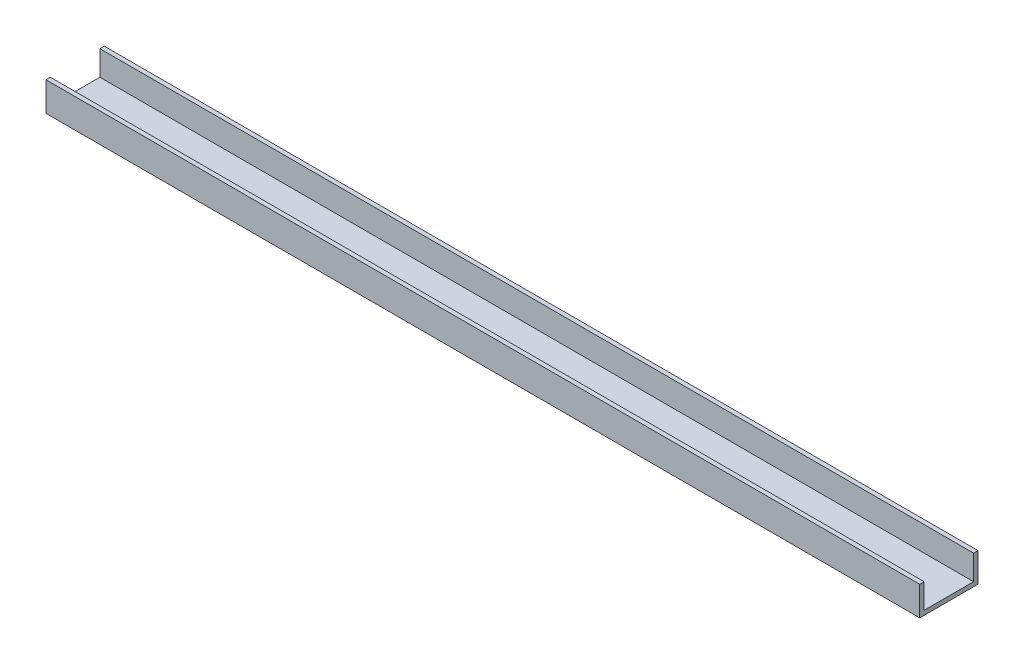
from build123d import *

# Parameters (mm, degrees)
BOSS_EXTRUDE1_DEPTH = 300


with BuildPart() as part:
    # Sketch1 → Boss-Extrude1 (new body)
    with BuildSketch(Plane(origin=(0, 0, 0), x_dir=(0, 0, -1), z_dir=(1, 0, 0))):
        Polygon((-10, -6.423948176), (10, -6.423948176), (10, 3.576051824), (8.5, 3.576051824), (8.5, -4.923948176), (-8.5, -4.923948176), (-8.5, 3.576051824), (-10, 3.576051824), align=None)
    extrude(amount=BOSS_EXTRUDE1_DEPTH)


solid = part.part
